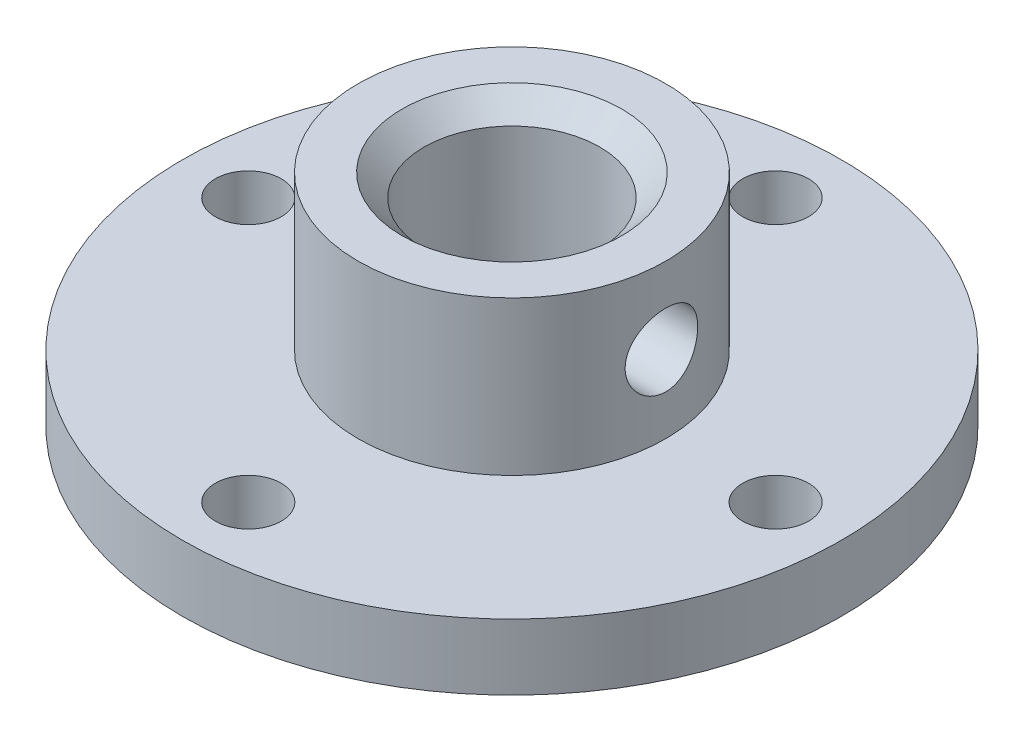
from build123d import *

# Parameters (mm, degrees)
SKETCH_1_R          = 15
SKETCH_1_R_2        = 4
EXTRUDE_1_DEPTH     = 3
SKETCH_2_R          = 7
SKETCH_2_R_2        = 4
EXTRUDE_2_DEPTH     = 7
SKETCH_5_R          = 1.65
CUT_EXTRUDE_1_DEPTH = 12
SKETCH_6_R          = 6.5
CUT_EXTRUDE_2_DEPTH = 1.5
SKETCH_7_R          = 1.5
CUT_EXTRUDE_3_DEPTH = 4
CHAMFER_1_SIZE      = 1


with BuildPart() as part:
    # 草图1 → 凸台-拉伸1 (new body)
    with BuildSketch(Plane(origin=(0, 0, 0), x_dir=(1, 0, 0), z_dir=(0, 1, 0))):
        Circle(SKETCH_1_R)
        Circle(SKETCH_1_R_2, mode=Mode.SUBTRACT)
    extrude(amount=EXTRUDE_1_DEPTH)

    # 草图2 → 凸台-拉伸2 (add)
    with BuildSketch(Plane(origin=(0, 3, 0), x_dir=(1, 0, 0), z_dir=(0, 1, 0))):
        Circle(SKETCH_2_R)
        Circle(SKETCH_2_R_2, mode=Mode.SUBTRACT)
    extrude(amount=EXTRUDE_2_DEPTH)

    # 草图5 → 切除-拉伸1 (cut)
    with BuildSketch(Plane.ZY):
        with Locations((0, 6.5)):
            Circle(SKETCH_5_R)
    extrude(amount=-CUT_EXTRUDE_1_DEPTH, mode=Mode.SUBTRACT)

    # 草图6 → 切除-拉伸2 (cut)
    with BuildSketch(Plane.XZ):
        Circle(SKETCH_6_R)
    extrude(amount=-CUT_EXTRUDE_2_DEPTH, mode=Mode.SUBTRACT)

    # 草图7 → 切除-拉伸3 (cut)
    with BuildSketch(Plane(origin=(0, 3, 0), x_dir=(1, 0, 0), z_dir=(0, 1, 0))):
        with Locations((0, -12)):
            Circle(SKETCH_7_R)
        with Locations((-12, 0)):
            Circle(SKETCH_7_R)
        with Locations((0, 12)):
            Circle(SKETCH_7_R)
        with Locations((12, 0)):
            Circle(SKETCH_7_R)
    extrude(amount=-CUT_EXTRUDE_3_DEPTH, mode=Mode.SUBTRACT)

    # 倒角1
    chamfer_1_edges = [part.edges().sort_by_distance(p)[0] for p in [
        (-4, 10, 0),
    ]]
    chamfer(chamfer_1_edges, length=CHAMFER_1_SIZE)


solid = part.part
